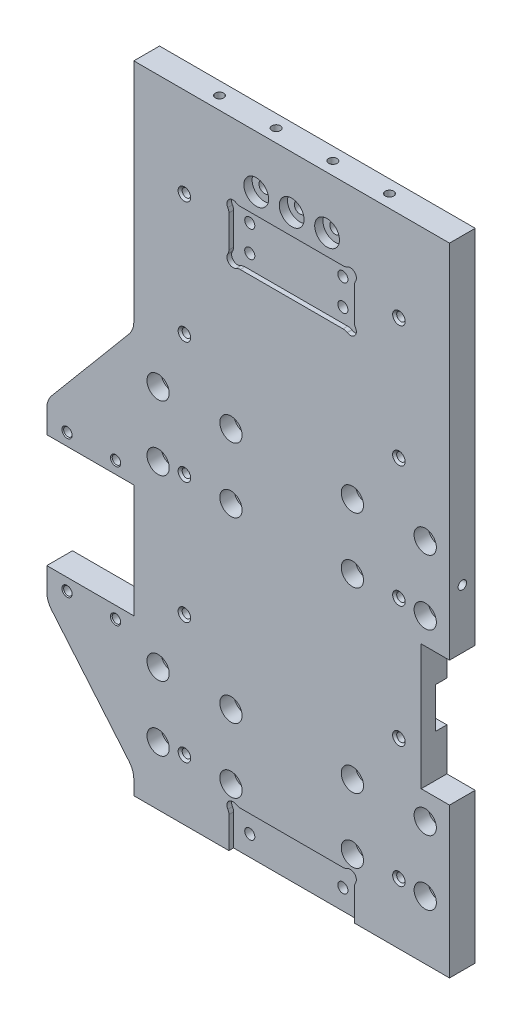
from build123d import *

# Parameters (mm, degrees)
SKETCH1_W                               = 156
SKETCH1_H                               = 314.5
SKETCH1_R                               = 2.55
BOSS_EXTRUDE1_DEPTH                     = 12.7
SKETCH2_R                               = 5.5
CUT_EXTRUDE1_DEPTH                      = 7
M5X0_8_TAPPED_HOLE5_D                   = 4.2
CHAMFER1_SIZE                           = 1
M5X0_8_TAPPED_HOLE3_D                   = 4.2
M5X0_8_TAPPED_HOLE3_DEPTH               = 20.4
M5X0_8_TAPPED_HOLE3_TIP                 = 1.2618073
SKETCH8_W                               = 14
SKETCH8_H                               = 62
CUT_EXTRUDE3_DEPTH                      = 224.909669287
SKETCH9_W                               = 156
SKETCH9_H                               = 20
CUT_EXTRUDE_THIN1_DEPTH                 = 5.5
SKETCH10_R                              = 2.1
BOSS_EXTRUDE2_DEPTH                     = 12.7
FILLET1_R                               = 10
M5X0_8_TAPPED_HOLE2_D                   = 4.2
M5X0_8_TAPPED_HOLE2_CSINK_D             = 5.05
M5X0_8_TAPPED_HOLE2_CSINK_ANGLE         = 90
M6X1_0_TAPPED_HOLE2_D                   = 5
M6X1_0_TAPPED_HOLE2_CSINK_D             = 6.05
M6X1_0_TAPPED_HOLE2_CSINK_ANGLE         = 90
SKETCH16_W                              = 62
SKETCH16_H                              = 27
SKETCH16_H_2                            = 22
CUT_EXTRUDE4_DEPTH                      = 2.3
CBORE_FOR_M5_HEX_HEAD_BOLT1_D           = 5.5
CBORE_FOR_M5_HEX_HEAD_BOLT1_CBORE_D     = 12.24
CBORE_FOR_M5_HEX_HEAD_BOLT1_CBORE_DEPTH = 4.08
M5X0_8_TAPPED_HOLE4_D                   = 4.2
M5X0_8_TAPPED_HOLE4_DEPTH               = 24
M5X0_8_TAPPED_HOLE4_TIP                 = 1.2618073
SKETCH27_R                              = 3
CUT_EXTRUDE5_DEPTH                      = 2.3
FILLET2_R                               = 4


with BuildPart() as part:
    # Sketch1 → Boss-Extrude1 (new body)
    with BuildSketch(Plane.XY):
        with Locations((0, 52.25)):
            Rectangle(SKETCH1_W, SKETCH1_H)
        with Locations((30, -44)):
            Circle(SKETCH1_R, mode=Mode.SUBTRACT)
        with Locations((66, -44)):
            Circle(SKETCH1_R, mode=Mode.SUBTRACT)
        with Locations((30, -76)):
            Circle(SKETCH1_R, mode=Mode.SUBTRACT)
        with Locations((66, -76)):
            Circle(SKETCH1_R, mode=Mode.SUBTRACT)
        with Locations(Location((-66, -44, 0), (0, 0, 180))):
            Circle(SKETCH1_R, mode=Mode.SUBTRACT)
        with Locations(Location((-66, -76, 0), (0, 0, 180))):
            Circle(SKETCH1_R, mode=Mode.SUBTRACT)
        with Locations(Location((-30, -76, 0), (0, 0, 180))):
            Circle(SKETCH1_R, mode=Mode.SUBTRACT)
        with Locations(Location((-30, -44, 0), (0, 0, 180))):
            Circle(SKETCH1_R, mode=Mode.SUBTRACT)
        with Locations(Location((66, 76, 0), (0, 0, 180))):
            Circle(SKETCH1_R, mode=Mode.SUBTRACT)
        with Locations(Location((66, 44, 0), (0, 0, 180))):
            Circle(SKETCH1_R, mode=Mode.SUBTRACT)
        with Locations(Location((30, 76, 0), (0, 0, 180))):
            Circle(SKETCH1_R, mode=Mode.SUBTRACT)
        with Locations(Location((30, 44, 0), (0, 0, 180))):
            Circle(SKETCH1_R, mode=Mode.SUBTRACT)
        with Locations((-30, 76)):
            Circle(SKETCH1_R, mode=Mode.SUBTRACT)
        with Locations((-30, 44)):
            Circle(SKETCH1_R, mode=Mode.SUBTRACT)
        with Locations((-66, 76)):
            Circle(SKETCH1_R, mode=Mode.SUBTRACT)
        with Locations((-66, 44)):
            Circle(SKETCH1_R, mode=Mode.SUBTRACT)
    extrude(amount=BOSS_EXTRUDE1_DEPTH)

    # Sketch2 → Cut-Extrude1 (cut)
    with BuildSketch(Plane.XY.offset(12.7)):
        with Locations((-66, 76)):
            Circle(SKETCH2_R)
        with Locations((-30, 76)):
            Circle(SKETCH2_R)
        with Locations((-66, 44)):
            Circle(SKETCH2_R)
        with Locations((-30, 44)):
            Circle(SKETCH2_R)
        with Locations((30, 76)):
            Circle(SKETCH2_R)
        with Locations((66, 76)):
            Circle(SKETCH2_R)
        with Locations((30, 44)):
            Circle(SKETCH2_R)
        with Locations((66, 44)):
            Circle(SKETCH2_R)
        with Locations((-66, -44)):
            Circle(SKETCH2_R)
        with Locations((-30, -44)):
            Circle(SKETCH2_R)
        with Locations((-66, -76)):
            Circle(SKETCH2_R)
        with Locations((-30, -76)):
            Circle(SKETCH2_R)
        with Locations((30, -76)):
            Circle(SKETCH2_R)
        with Locations((30, -44)):
            Circle(SKETCH2_R)
        with Locations((66, -44)):
            Circle(SKETCH2_R)
        with Locations((66, -76)):
            Circle(SKETCH2_R)
    extrude(amount=-CUT_EXTRUDE1_DEPTH, mode=Mode.SUBTRACT)

    # M5x0.8 Tapped Hole5 (through all)
    with Locations(Plane(origin=(53, 165, 12.7), x_dir=(1, 0, 0), z_dir=(0, 0, 1))):
        with Locations((0, 0), (0, -60), (0, -120), (0, -180), (0, -240), (-106, 0), (-106, -60), (-106, -120), (-106, -180), (-106, -240)):
            Hole(M5X0_8_TAPPED_HOLE5_D / 2)

    # Chamfer1
    chamfer1_edges = [part.edges().sort_by_distance(p)[0] for p in [
        (-50.9, -75, 12.7),
        (-50.9, -15, 12.7),
        (-50.9, 45, 12.7),
        (-50.9, 105, 12.7),
        (-50.9, 165, 12.7),
        (55.1, -75, 12.7),
        (55.1, -15, 12.7),
        (55.1, 45, 12.7),
        (55.1, 105, 12.7),
        (55.1, 165, 12.7),
    ]]
    chamfer(chamfer1_edges, length=CHAMFER1_SIZE)

    # M5x0.8 Tapped Hole3
    with Locations(Plane(origin=(0, 209.5, 0), x_dir=(1, 0, 0), z_dir=(0, 1, 0))):
        with Locations((42, -6.35), (14, -6.35), (-14, -6.35), (-42, -6.35)):
            Hole(M5X0_8_TAPPED_HOLE3_D / 2, depth=M5X0_8_TAPPED_HOLE3_DEPTH)
            with Locations((0, 0, -(M5X0_8_TAPPED_HOLE3_DEPTH + M5X0_8_TAPPED_HOLE3_TIP / 2))):  # 118° drill point
                Cone(0, M5X0_8_TAPPED_HOLE3_D / 2, M5X0_8_TAPPED_HOLE3_TIP, mode=Mode.SUBTRACT)

    # Sketch8 → Cut-Extrude3 (cut, through all)
    with BuildSketch(Plane(origin=(0, 0, 0), x_dir=(-1, 0, 0), z_dir=(0, 0, -1))):
        with Locations((-71, 0)):
            Rectangle(SKETCH8_W, SKETCH8_H)
    extrude(amount=-CUT_EXTRUDE3_DEPTH, mode=Mode.SUBTRACT)

    # Sketch9 → Cut-Extrude-Thin1 (cut)
    with BuildSketch(Plane(origin=(0, 0, 0), x_dir=(-1, 0, 0), z_dir=(0, 0, -1))):
        Rectangle(SKETCH9_W, SKETCH9_H)
    extrude(amount=-CUT_EXTRUDE_THIN1_DEPTH, mode=Mode.SUBTRACT)

    # Sketch10 → Boss-Extrude2 (add)
    # profile 1 of 2: a face of its own
    with BuildSketch(Plane.XY.offset(12.7)):
        Polygon((-121, 28), (-121, 43), (-78, 94.245404482), (-78, 28), align=None)
        with Locations((-111, 34)):
            Circle(SKETCH10_R, mode=Mode.SUBTRACT)
        with Locations((-87, 34)):
            Circle(SKETCH10_R, mode=Mode.SUBTRACT)
    # profile 2 of 2: a face of its own
    with BuildSketch(Plane.XY.offset(12.7)):
        Polygon((-78, -28), (-78, -94.245404482), (-121, -43), (-121, -28), align=None)
        with Locations((-87, -34)):
            Circle(SKETCH10_R, mode=Mode.SUBTRACT)
        with Locations((-111, -34)):
            Circle(SKETCH10_R, mode=Mode.SUBTRACT)
    extrude(amount=-BOSS_EXTRUDE2_DEPTH)

    # Fillet1
    fillet1_edges = [part.edges().sort_by_distance(p)[0] for p in [
        (-78, 94.245404482, 6.35),
        (-121, 43, 6.35),
        (-121, -43, 6.35),
        (-78, -94.245404482, 6.35),
    ]]
    fillet(fillet1_edges, radius=FILLET1_R)

    # M5x0.8 Tapped Hole2 (through all)
    with Locations(Plane.XY.offset(12.7)):
        with Locations((-87, 34), (-111, 34), (-87, -34), (-111, -34)):
            CounterSinkHole(M5X0_8_TAPPED_HOLE2_D / 2, M5X0_8_TAPPED_HOLE2_CSINK_D / 2, counter_sink_angle=M5X0_8_TAPPED_HOLE2_CSINK_ANGLE)

    # M6x1.0 Tapped Hole2 (through all)
    with Locations(Plane.XY.offset(12.7)):
        with Locations((-23, 166.5), (23, 166.5), (-23, 153.5), (23, 153.5), (-23, -95), (23, -95)):
            CounterSinkHole(M6X1_0_TAPPED_HOLE2_D / 2, M6X1_0_TAPPED_HOLE2_CSINK_D / 2, counter_sink_angle=M6X1_0_TAPPED_HOLE2_CSINK_ANGLE)

    # Sketch16 → Cut-Extrude4 (cut)
    with BuildSketch(Plane.XY.offset(12.7)):
        with Locations((0, 160)):
            Rectangle(SKETCH16_W, SKETCH16_H)
        with Locations((0, -95)):
            Rectangle(SKETCH16_W, SKETCH16_H_2)
    extrude(amount=-CUT_EXTRUDE4_DEPTH, mode=Mode.SUBTRACT)

    # CBORE for M5 Hex Head Bolt1 (through all)
    with Locations(Plane.XY.offset(12.7)):
        with Locations((-17.5, 183.65), (0, 183.65), (17.5, 183.65)):
            CounterBoreHole(CBORE_FOR_M5_HEX_HEAD_BOLT1_D / 2, CBORE_FOR_M5_HEX_HEAD_BOLT1_CBORE_D / 2, CBORE_FOR_M5_HEX_HEAD_BOLT1_CBORE_DEPTH)

    # M5x0.8 Tapped Hole4
    with Locations(Plane(origin=(78, 0, 0), x_dir=(0, 0, -1), z_dir=(1, 0, 0))):
        with Locations((-6.35, 60)):
            Hole(M5X0_8_TAPPED_HOLE4_D / 2, depth=M5X0_8_TAPPED_HOLE4_DEPTH)
            with Locations((0, 0, -(M5X0_8_TAPPED_HOLE4_DEPTH + M5X0_8_TAPPED_HOLE4_TIP / 2))):  # 118° drill point
                Cone(0, M5X0_8_TAPPED_HOLE4_D / 2, M5X0_8_TAPPED_HOLE4_TIP, mode=Mode.SUBTRACT)

    # Sketch27 → Cut-Extrude5 (cut)
    with BuildSketch(Plane.XY.offset(10.4)):
        with Locations((-28.978679656, 171.478679656)):
            Circle(SKETCH27_R)
        with Locations((28.978679656, 171.478679656)):
            Circle(SKETCH27_R)
        with Locations((28.978679656, 148.521320344)):
            Circle(SKETCH27_R)
        with Locations((-28.978679656, 148.521320344)):
            Circle(SKETCH27_R)
        with Locations((-28.978679656, -86.021320344)):
            Circle(SKETCH27_R)
        with Locations((28.978679656, -86.021320344)):
            Circle(SKETCH27_R)
    extrude(amount=CUT_EXTRUDE5_DEPTH, mode=Mode.SUBTRACT)

    # Fillet2
    fillet2_edges = [part.edges().sort_by_distance(p)[0] for p in [
        (26.761865711, -84, 11.55),
        (-26.761865711, -84, 11.55),
        (-26.761865711, 173.5, 11.55),
        (26.761865711, 173.5, 11.55),
        (-31, 150.738134289, 11.55),
        (26.761865711, 146.5, 11.55),
        (31, 169.261865711, 11.55),
        (31, 150.738134289, 11.55),
        (-26.761865711, 146.5, 11.55),
        (-31, -88.238134289, 11.55),
        (31, -88.238134289, 11.55),
        (-31, 169.261865711, 11.55),
    ]]
    fillet(fillet2_edges, radius=FILLET2_R)


solid = part.part
